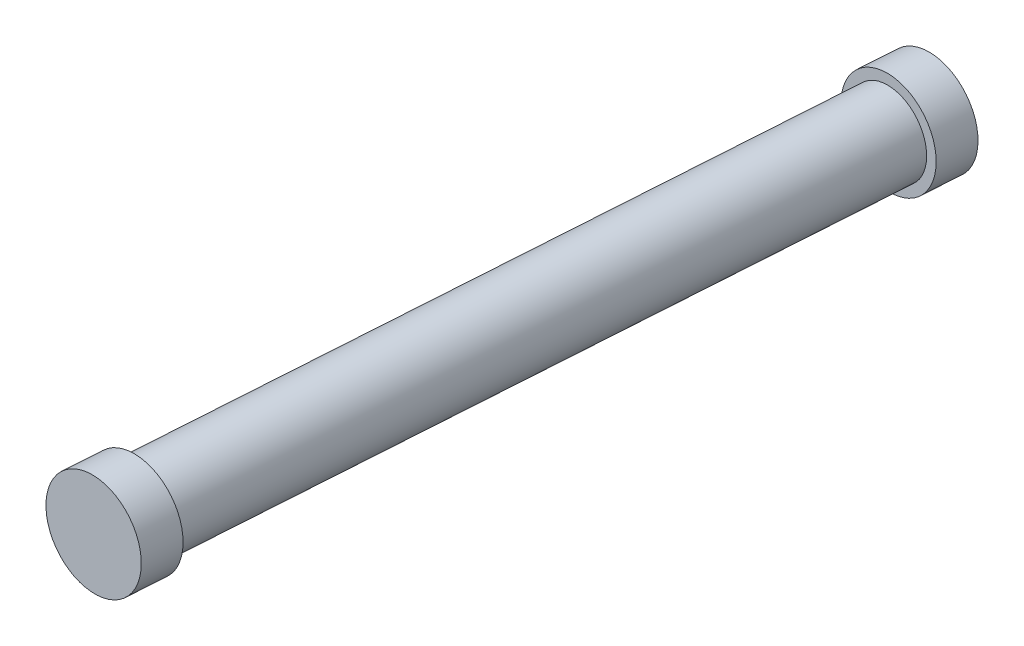
from build123d import *

# Parameters (mm, degrees)
SKETCH1_R           = 1
BOSS_EXTRUDE1_DEPTH = 18
SKETCH2_R           = 1.25
BOSS_EXTRUDE2_DEPTH = 1


with BuildPart() as part:
    # Sketch1 → Boss-Extrude1 (new body)
    with BuildSketch(Plane(origin=(-3.774347483, 1.505086334, 80.82202498), x_dir=(0.9989117358115743, 0.0008684011141373105, 0.04663249872580849), z_dir=(-0.04664058380753361, 0.018598739412937847, 0.9987385758216923))):
        with Locations(Location((1103.998324858, -68.019334286, 0), (0, 0, 359.950235667))):
            Circle(SKETCH1_R)
    extrude(amount=-BOSS_EXTRUDE1_DEPTH)

    # Sketch2 → Boss-Extrude2 (add)
    with BuildSketch(Plane(origin=(-3.774347483, 1.505086334, 80.82202498), x_dir=(0.9989117358115743, 0.0008684011141373106, 0.046632498725808505), z_dir=(-0.04664058380753362, 0.01859873941293785, 0.9987385758216923))):
        with Locations(Location((1103.998324858, -68.019334286, 0), (0, 0, 359.950235667))):
            Circle(SKETCH2_R)
    boss_extrude2 = extrude(amount=BOSS_EXTRUDE2_DEPTH)

    # Mirror1: Boss-Extrude2 across plane
    add(boss_extrude2.mirror(Plane(origin=(-3.354582228, 1.337697679, 71.833377798), x_dir=(0.9989117358115743, 0.000868401114137311, 0.04663249872580852), z_dir=(-0.04664058380753362, 0.01859873941293785, 0.9987385758216923))))


solid = part.part
